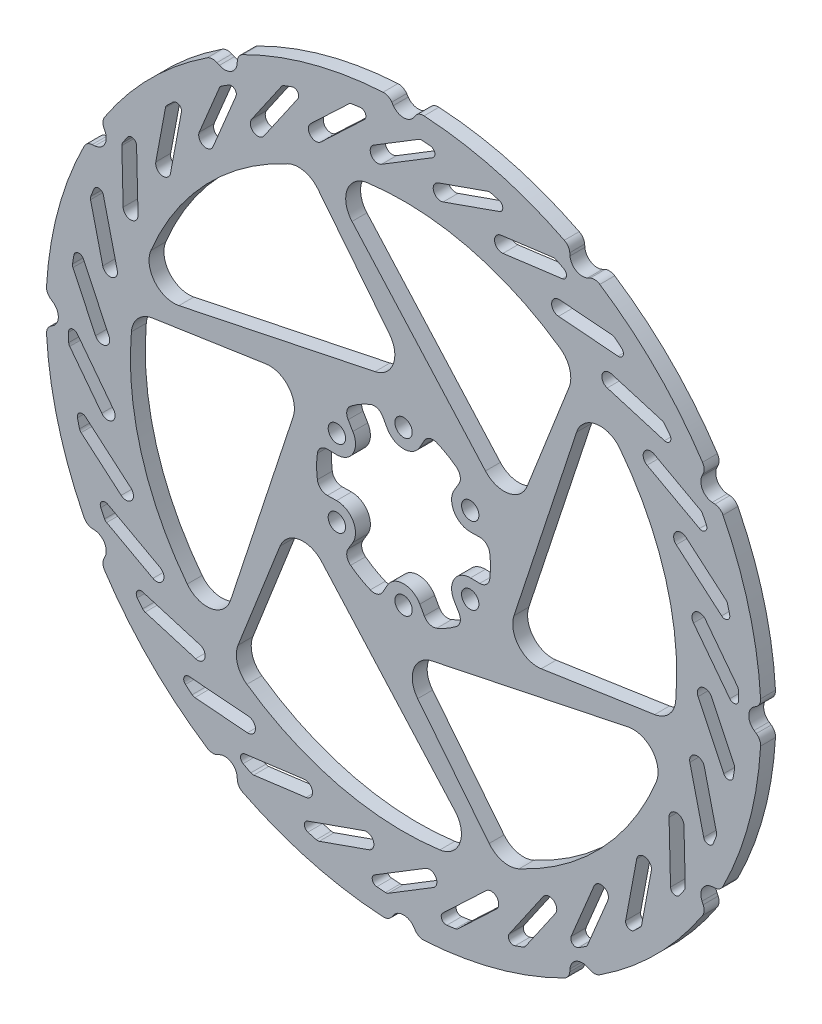
from build123d import *

# Parameters (mm, degrees)
BOSS_EXTRUDE1_DEPTH = 3
CUT_EXTRUDE1_DEPTH  = 3
SKETCH3_R           = 1.75
CUT_EXTRUDE2_DEPTH  = 3
CUT_EXTRUDE3_DEPTH  = 3


with BuildPart() as part:
    # Sketch1 → Boss-Extrude1 (new body)
    with BuildSketch(Plane.XY):
        with BuildLine():
            Line((2.053618112, 70.574288722), (2.366955706, 71.025625375))
            ThreePointArc((2.366955706, 71.025625375), (3.133954664, 71.683057192), (4.124417344, 71.881772248))
            ThreePointArc((4.124417344, 71.881772248), (18.634971247, 69.546659493), (32.369035928, 64.313649508))
            ThreePointArc((32.369035928, 64.313649508), (33.127444243, 63.646325881), (33.462968917, 62.693473748))
            Line((33.462968917, 62.693473748), (33.508658906, 62.145935943))
            ThreePointArc((33.508658906, 62.145935943), (34.75, 60.188765563), (37.065629816, 60.092317831))
            Line((37.065629816, 60.092317831), (37.562656459, 60.326518042))
            ThreePointArc((37.562656459, 60.326518042), (38.555612949, 60.512371217), (39.51273632, 60.189232164))
            ThreePointArc((39.51273632, 60.189232164), (50.911688245, 50.911688245), (60.189232164, 39.51273632))
            ThreePointArc((60.189232164, 39.51273632), (60.512371217, 38.555612949), (60.326518042, 37.562656459))
            Line((60.326518042, 37.562656459), (60.092317831, 37.065629816))
            ThreePointArc((60.092317831, 37.065629816), (60.188765563, 34.75), (62.145935943, 33.508658906))
            Line((62.145935943, 33.508658906), (62.693473748, 33.462968917))
            ThreePointArc((62.693473748, 33.462968917), (63.646325881, 33.127444243), (64.313649508, 32.369035928))
            ThreePointArc((64.313649508, 32.369035928), (69.546659493, 18.634971247), (71.881772248, 4.124417344))
            ThreePointArc((71.881772248, 4.124417344), (71.683057192, 3.133954664), (71.025625375, 2.366955706))
            Line((71.025625375, 2.366955706), (70.574288722, 2.053618112))
            ThreePointArc((70.574288722, 2.053618112), (69.5, 0), (70.574288722, -2.053618112))
            Line((70.574288722, -2.053618112), (71.025625375, -2.366955706))
            ThreePointArc((71.025625375, -2.366955706), (71.683057192, -3.133954664), (71.881772248, -4.124417344))
            ThreePointArc((71.881772248, -4.124417344), (69.546659493, -18.634971247), (64.313649508, -32.369035928))
            ThreePointArc((64.313649508, -32.369035928), (63.646325881, -33.127444243), (62.693473748, -33.462968917))
            Line((62.693473748, -33.462968917), (62.145935943, -33.508658906))
            ThreePointArc((62.145935943, -33.508658906), (60.188765563, -34.75), (60.092317831, -37.065629816))
            Line((60.092317831, -37.065629816), (60.326518042, -37.562656459))
            ThreePointArc((60.326518042, -37.562656459), (60.512371217, -38.555612949), (60.189232164, -39.51273632))
            ThreePointArc((60.189232164, -39.51273632), (50.911688245, -50.911688245), (39.51273632, -60.189232164))
            ThreePointArc((39.51273632, -60.189232164), (38.555612949, -60.512371217), (37.562656459, -60.326518042))
            Line((37.562656459, -60.326518042), (37.065629816, -60.092317831))
            ThreePointArc((37.065629816, -60.092317831), (34.75, -60.188765563), (33.508658906, -62.145935943))
            Line((33.508658906, -62.145935943), (33.462968917, -62.693473748))
            ThreePointArc((33.462968917, -62.693473748), (33.127444243, -63.646325881), (32.369035928, -64.313649508))
            ThreePointArc((32.369035928, -64.313649508), (18.634971247, -69.546659493), (4.124417344, -71.881772248))
            ThreePointArc((4.124417344, -71.881772248), (3.133954664, -71.683057192), (2.366955706, -71.025625375))
            Line((2.366955706, -71.025625375), (2.053618112, -70.574288722))
            ThreePointArc((2.053618112, -70.574288722), (0, -69.5), (-2.053618112, -70.574288722))
            Line((-2.053618112, -70.574288722), (-2.366955706, -71.025625375))
            ThreePointArc((-2.366955706, -71.025625375), (-3.133954664, -71.683057192), (-4.124417344, -71.881772248))
            ThreePointArc((-4.124417344, -71.881772248), (-18.634971247, -69.546659493), (-32.369035928, -64.313649508))
            ThreePointArc((-32.369035928, -64.313649508), (-33.127444243, -63.646325881), (-33.462968917, -62.693473748))
            Line((-33.462968917, -62.693473748), (-33.508658906, -62.145935943))
            ThreePointArc((-33.508658906, -62.145935943), (-34.75, -60.188765563), (-37.065629816, -60.092317831))
            Line((-37.065629816, -60.092317831), (-37.562656459, -60.326518042))
            ThreePointArc((-37.562656459, -60.326518042), (-38.555612949, -60.512371217), (-39.51273632, -60.189232164))
            ThreePointArc((-39.51273632, -60.189232164), (-50.911688245, -50.911688245), (-60.189232164, -39.51273632))
            ThreePointArc((-60.189232164, -39.51273632), (-60.512371217, -38.555612949), (-60.326518042, -37.562656458))
            Line((-60.326518042, -37.562656458), (-60.092317831, -37.065629816))
            ThreePointArc((-60.092317831, -37.065629816), (-60.188765563, -34.75), (-62.145935943, -33.508658906))
            Line((-62.145935943, -33.508658906), (-62.693473748, -33.462968917))
            ThreePointArc((-62.693473748, -33.462968917), (-63.646325881, -33.127444243), (-64.313649508, -32.369035928))
            ThreePointArc((-64.313649508, -32.369035928), (-69.546659493, -18.634971247), (-71.881772248, -4.124417344))
            ThreePointArc((-71.881772248, -4.124417344), (-71.683057192, -3.133954664), (-71.025625375, -2.366955706))
            Line((-71.025625375, -2.366955706), (-70.574288722, -2.053618112))
            ThreePointArc((-70.574288722, -2.053618112), (-69.5, 0), (-70.574288722, 2.053618112))
            Line((-70.574288722, 2.053618112), (-71.025625375, 2.366955706))
            ThreePointArc((-71.025625375, 2.366955706), (-71.683057192, 3.133954664), (-71.881772248, 4.124417344))
            ThreePointArc((-71.881772248, 4.124417344), (-69.546659493, 18.634971247), (-64.313649508, 32.369035928))
            ThreePointArc((-64.313649508, 32.369035928), (-63.646325881, 33.127444243), (-62.693473748, 33.462968917))
            Line((-62.693473748, 33.462968917), (-62.145935943, 33.508658906))
            ThreePointArc((-62.145935943, 33.508658906), (-60.188765563, 34.75), (-60.092317831, 37.065629816))
            Line((-60.092317831, 37.065629816), (-60.326518042, 37.562656459))
            ThreePointArc((-60.326518042, 37.562656459), (-60.512371217, 38.555612949), (-60.189232164, 39.51273632))
            ThreePointArc((-60.189232164, 39.51273632), (-50.911688245, 50.911688245), (-39.51273632, 60.189232164))
            ThreePointArc((-39.51273632, 60.189232164), (-38.555612949, 60.512371217), (-37.562656459, 60.326518042))
            Line((-37.562656459, 60.326518042), (-37.065629816, 60.092317831))
            ThreePointArc((-37.065629816, 60.092317831), (-34.75, 60.188765563), (-33.508658906, 62.145935943))
            Line((-33.508658906, 62.145935943), (-33.462968917, 62.693473748))
            ThreePointArc((-33.462968917, 62.693473748), (-33.127444243, 63.646325881), (-32.369035928, 64.313649508))
            ThreePointArc((-32.369035928, 64.313649508), (-18.634971247, 69.546659493), (-4.124417344, 71.881772248))
            ThreePointArc((-4.124417344, 71.881772248), (-3.133954664, 71.683057192), (-2.366955706, 71.025625375))
            Line((-2.366955706, 71.025625375), (-2.053618112, 70.574288722))
            ThreePointArc((-2.053618112, 70.574288722), (0, 69.5), (2.053618112, 70.574288722))
        make_face()
    extrude(amount=BOSS_EXTRUDE1_DEPTH)

    # Sketch2 → Cut-Extrude1 (cut)
    with BuildSketch(Plane.XY.offset(3)):
        with BuildLine():
            Line((3.063050298, 67.256681304), (-5.992723389, 61.724264749))
            ThreePointArc((-5.992723389, 61.724264749), (-6.490747582, 59.662233735), (-4.428716568, 59.164209541))
            Line((-4.428716568, 59.164209541), (5.834166321, 65.434081687))
            ThreePointArc((5.834166321, 65.434081687), (6.28552662, 66.51951676), (5.392722905, 67.284236933))
            ThreePointArc((5.392722905, 67.284236933), (4.515887753, 67.348769534), (3.638286445, 67.401875877))
            ThreePointArc((3.638286445, 67.401875877), (3.339652884, 67.372920073), (3.063050298, 67.256681304))
        make_face()
        with BuildLine():
            Line((16.979565628, 65.150117484), (6.971428244, 61.621398723))
            ThreePointArc((6.971428244, 61.621398723), (6.055566719, 59.707973086), (7.968992356, 58.792111562))
            Line((7.968992356, 58.792111562), (19.31118635, 62.791198624))
            ThreePointArc((19.31118635, 62.791198624), (19.978357984, 63.759071253), (19.264058437, 64.692704786))
            ThreePointArc((19.264058437, 64.692704786), (18.41980132, 64.938131474), (17.572419135, 65.172540888))
            ThreePointArc((17.572419135, 65.172540888), (17.274291183, 65.206307246), (16.979565628, 65.150117484))
        make_face()
        with BuildLine():
            Line((30.153992464, 60.196180905), (19.63089501, 58.825381881))
            ThreePointArc((19.63089501, 58.825381881), (18.337223697, 57.144187504), (20.018418075, 55.850516191))
            Line((20.018418075, 55.850516191), (31.94421487, 57.404038876))
            ThreePointArc((31.94421487, 57.404038876), (32.798039238, 58.212048383), (32.293462177, 59.27379101))
            ThreePointArc((32.293462177, 59.27379101), (31.51868118, 59.689385461), (30.738552786, 60.094853129))
            ThreePointArc((30.738552786, 60.094853129), (30.453960067, 60.189865898), (30.153992464, 60.196180905))
        make_face()
        with BuildLine():
            Line((42.010545134, 52.611382368), (31.432397464, 53.458413576))
            ThreePointArc((31.432397464, 53.458413576), (29.817456008, 52.082926719), (31.192942865, 50.467985263))
            Line((31.192942865, 50.467985263), (43.181127915, 49.508047173))
            ThreePointArc((43.181127915, 49.508047173), (44.184288795, 50.120879666), (43.911486657, 51.264328139))
            ThreePointArc((43.911486657, 51.264328139), (43.24004343, 51.831926881), (42.561264182, 52.390731921))
            ThreePointArc((42.561264182, 52.390731921), (42.302644761, 52.542838587), (42.010545134, 52.611382368))
        make_face()
        with BuildLine():
            Line((52.031035393, 42.727213963), (41.86015332, 45.755056075))
            ThreePointArc((41.86015332, 45.755056075), (39.994522411, 44.745392115), (41.004186372, 42.879761206))
            Line((41.004186372, 42.879761206), (52.530818464, 39.448316243))
            ThreePointArc((52.530818464, 39.448316243), (53.639472912, 39.839188001), (53.610368461, 41.014368135))
            ThreePointArc((53.610368461, 41.014368135), (53.071608292, 41.70916438), (52.5238441, 42.39688433))
            ThreePointArc((52.5238441, 42.39688433), (52.302500889, 42.599437101), (52.031035393, 42.727213963))
        make_face()
        with BuildLine():
            Line((59.777519732, 30.975661281), (50.458419608, 36.051983067))
            ThreePointArc((50.458419608, 36.051983067), (48.42363627, 35.452269163), (49.023350174, 33.417485825))
            Line((49.023350174, 33.417485825), (59.584660175, 27.6645046))
            ThreePointArc((59.584660175, 27.6645046), (60.750354671, 27.816332651), (60.966219911, 28.971883435))
            ThreePointArc((60.966219911, 28.971883435), (60.583689207, 29.763511252), (60.190879995, 30.550089451))
            ThreePointArc((60.190879995, 30.550089451), (60.016486753, 30.794235799), (59.777519732, 30.975661281))
        make_face()
        with BuildLine():
            Line((64.911439615, 17.870323562), (56.851410833, 24.773265402))
            ThreePointArc((56.851410833, 24.773265402), (54.736404861, 24.60971193), (54.899958333, 22.494705958))
            Line((54.899958333, 22.494705958), (64.034366318, 14.671621356))
            ThreePointArc((64.034366318, 14.671621356), (65.206154419, 14.577770086), (65.657555003, 15.663188406))
            ThreePointArc((65.657555003, 15.663188406), (65.447972191, 16.517049862), (65.227285605, 17.368109067))
            ThreePointArc((65.227285605, 17.368109067), (65.107464154, 17.643178626), (64.911439615, 17.870323562))
        make_face()
        with BuildLine():
            Line((67.208418107, 3.983966953), (60.759722602, 12.411837163))
            ThreePointArc((60.759722602, 12.411837163), (58.656929906, 12.691592195), (58.377174874, 10.588799499))
            Line((58.377174874, 10.588799499), (65.685463381, 1.037517857))
            ThreePointArc((65.685463381, 1.037517857), (66.812132325, 0.702089017), (67.479339881, 1.669936884))
            ThreePointArc((67.479339881, 1.669936884), (67.451864735, 2.548714135), (67.41294584, 3.427058976))
            ThreePointArc((67.41294584, 3.427058976), (67.352932952, 3.721029885), (67.208418107, 3.983966953))
        make_face()
        with BuildLine():
            Line((66.568066226, -10.076508129), (62.012542935, -0.492047918))
            ThreePointArc((62.012542935, -0.492047918), (60.013865646, 0.21878898), (59.303028748, -1.779888309))
            Line((59.303028748, -1.779888309), (64.465790501, -12.641930152))
            ThreePointArc((64.465790501, -12.641930152), (65.498099448, -13.204276712), (66.351953805, -12.396298894))
            ThreePointArc((66.351953805, -12.396298894), (66.507787121, -11.53101263), (66.652336858, -10.663770038))
            ThreePointArc((66.652336858, -10.663770038), (66.654755384, -10.363745717), (66.568066226, -10.076508129))
        make_face()
        with BuildLine():
            Line((63.018370421, -23.696591454), (60.555117572, -13.374428144))
            ThreePointArc((60.555117572, -13.374428144), (58.747907479, -12.263576363), (57.637055698, -14.070786456))
            Line((57.637055698, -14.070786456), (60.428653235, -25.768865149))
            ThreePointArc((60.428653235, -25.768865149), (61.321485331, -26.533552186), (62.324668955, -25.920756926))
            ThreePointArc((62.324668955, -25.920756926), (62.65700007, -25.106778811), (62.978700922, -24.28854113))
            ThreePointArc((62.978700922, -24.28854113), (63.043445161, -23.995575901), (63.018370421, -23.696591454))
        make_face()
        with BuildLine():
            Line((56.714469434, -36.281020023), (56.451142997, -25.672281682))
            ThreePointArc((56.451142997, -25.672281682), (54.914383852, -24.209964572), (53.452066742, -25.746723717))
            Line((53.452066742, -25.746723717), (53.750493854, -37.769577088))
            ThreePointArc((53.750493854, -37.769577088), (54.464828051, -38.703184109), (55.573497006, -38.312353498))
            ThreePointArc((55.573497006, -38.312353498), (56.067801454, -37.585258282), (56.55259355, -36.851786426))
            ThreePointArc((56.55259355, -36.851786426), (56.676833869, -36.578684274), (56.714469434, -36.281020023))
        make_face()
        with BuildLine():
            Line((47.931873986, -47.279793921), (49.879982589, -36.848133322))
            ThreePointArc((49.879982589, -36.848133322), (48.680838142, -35.098261157), (46.930965977, -36.297405604))
            Line((46.930965977, -36.297405604), (44.723179968, -48.119577268))
            ThreePointArc((44.723179968, -48.119577268), (45.227796435, -49.181301167), (46.393496565, -49.02951638))
            ThreePointArc((46.393496565, -49.02951638), (47.028170871, -48.421081612), (47.654866471, -47.80443182))
            ThreePointArc((47.654866471, -47.80443182), (47.833172971, -47.56312862), (47.931873986, -47.279793921))
        make_face()
        with BuildLine():
            Line((37.054425643, -56.212213952), (41.128827592, -46.413544718))
            ThreePointArc((41.128827592, -46.413544718), (40.319706208, -44.452595309), (38.358756799, -45.261716692))
            Line((38.358756799, -45.261716692), (33.741248511, -56.366521019))
            ThreePointArc((33.741248511, -56.366521019), (34.014093087, -57.509959366), (35.185877705, -57.603854126))
            ThreePointArc((35.185877705, -57.603854126), (35.933183555, -57.140671326), (36.674393053, -56.667794153))
            ThreePointArc((36.674393053, -56.667794153), (36.898972885, -56.468836013), (37.054425643, -56.212213952))
        make_face()
        with BuildLine():
            Line((24.557521092, -62.687890497), (30.580145471, -53.950461494))
            ThreePointArc((30.580145471, -53.950461494), (30.196409638, -51.864137739), (28.110085883, -52.247873571))
            Line((28.110085883, -52.247873571), (21.284662586, -62.149977325))
            ThreePointArc((21.284662586, -62.149977325), (21.313810653, -63.325156378), (22.440467148, -63.660627033))
            ThreePointArc((22.440467148, -63.660627033), (23.267743691, -63.362939511), (24.091072676, -63.054501959))
            ThreePointArc((24.091072676, -63.054501959), (24.352110623, -62.906584304), (24.557521092, -62.687890497))
        make_face()
        with BuildLine():
            Line((10.987335029, -66.423805417), (18.694964253, -59.129484219))
            ThreePointArc((18.694964253, -59.129484219), (18.753385068, -57.008968478), (16.632869327, -56.950547662))
            Line((16.632869327, -56.950547662), (7.897834771, -65.217181393))
            ThreePointArc((7.897834771, -65.217181393), (7.682012419, -66.372740188), (8.714300495, -66.935125061))
            ThreePointArc((8.714300495, -66.935125061), (9.585391777, -66.815943191), (10.454856821, -66.68542546))
            ThreePointArc((10.454856821, -66.68542546), (10.740944272, -66.595013002), (10.987335029, -66.423805417))
        make_face()
        with BuildLine():
            Line((-3.063050298, -67.256681304), (5.992723389, -61.724264749))
            ThreePointArc((5.992723389, -61.724264749), (6.490747582, -59.662233735), (4.428716568, -59.164209541))
            Line((4.428716568, -59.164209541), (-5.834166321, -65.434081687))
            ThreePointArc((-5.834166321, -65.434081687), (-6.28552662, -66.51951676), (-5.392722905, -67.284236933))
            ThreePointArc((-5.392722905, -67.284236933), (-4.515887753, -67.348769534), (-3.638286445, -67.401875877))
            ThreePointArc((-3.638286445, -67.401875877), (-3.339652884, -67.372920073), (-3.063050298, -67.256681304))
        make_face()
        with BuildLine():
            Line((-16.979565628, -65.150117484), (-6.971428244, -61.621398723))
            ThreePointArc((-6.971428244, -61.621398723), (-6.055566719, -59.707973086), (-7.968992356, -58.792111562))
            Line((-7.968992356, -58.792111562), (-19.31118635, -62.791198624))
            ThreePointArc((-19.31118635, -62.791198624), (-19.978357984, -63.759071253), (-19.264058437, -64.692704786))
            ThreePointArc((-19.264058437, -64.692704786), (-18.41980132, -64.938131474), (-17.572419135, -65.172540888))
            ThreePointArc((-17.572419135, -65.172540888), (-17.274291183, -65.206307246), (-16.979565628, -65.150117484))
        make_face()
        with BuildLine():
            Line((-30.153992464, -60.196180905), (-19.63089501, -58.825381881))
            ThreePointArc((-19.63089501, -58.825381881), (-18.337223697, -57.144187504), (-20.018418075, -55.850516191))
            Line((-20.018418075, -55.850516191), (-31.94421487, -57.404038876))
            ThreePointArc((-31.94421487, -57.404038876), (-32.798039238, -58.212048383), (-32.293462177, -59.27379101))
            ThreePointArc((-32.293462177, -59.27379101), (-31.51868118, -59.689385461), (-30.738552786, -60.094853129))
            ThreePointArc((-30.738552786, -60.094853129), (-30.453960067, -60.189865898), (-30.153992464, -60.196180905))
        make_face()
        with BuildLine():
            Line((-42.010545134, -52.611382368), (-31.432397464, -53.458413576))
            ThreePointArc((-31.432397464, -53.458413576), (-29.817456008, -52.082926719), (-31.192942865, -50.467985263))
            Line((-31.192942865, -50.467985263), (-43.181127915, -49.508047173))
            ThreePointArc((-43.181127915, -49.508047173), (-44.184288795, -50.120879666), (-43.911486657, -51.264328139))
            ThreePointArc((-43.911486657, -51.264328139), (-43.24004343, -51.831926881), (-42.561264182, -52.390731921))
            ThreePointArc((-42.561264182, -52.390731921), (-42.302644761, -52.542838587), (-42.010545134, -52.611382368))
        make_face()
        with BuildLine():
            Line((-52.031035393, -42.727213963), (-41.86015332, -45.755056075))
            ThreePointArc((-41.86015332, -45.755056075), (-39.994522411, -44.745392115), (-41.004186372, -42.879761206))
            Line((-41.004186372, -42.879761206), (-52.530818464, -39.448316243))
            ThreePointArc((-52.530818464, -39.448316243), (-53.639472912, -39.839188001), (-53.610368461, -41.014368135))
            ThreePointArc((-53.610368461, -41.014368135), (-53.071608292, -41.70916438), (-52.5238441, -42.39688433))
            ThreePointArc((-52.5238441, -42.39688433), (-52.302500889, -42.599437101), (-52.031035393, -42.727213963))
        make_face()
        with BuildLine():
            Line((-59.777519732, -30.975661281), (-50.458419608, -36.051983067))
            ThreePointArc((-50.458419608, -36.051983067), (-48.42363627, -35.452269163), (-49.023350174, -33.417485825))
            Line((-49.023350174, -33.417485825), (-59.584660175, -27.6645046))
            ThreePointArc((-59.584660175, -27.6645046), (-60.750354671, -27.816332651), (-60.966219911, -28.971883435))
            ThreePointArc((-60.966219911, -28.971883435), (-60.583689207, -29.763511252), (-60.190879995, -30.550089451))
            ThreePointArc((-60.190879995, -30.550089451), (-60.016486753, -30.794235799), (-59.777519732, -30.975661281))
        make_face()
        with BuildLine():
            Line((-64.911439615, -17.870323562), (-56.851410833, -24.773265402))
            ThreePointArc((-56.851410833, -24.773265402), (-54.736404861, -24.60971193), (-54.899958333, -22.494705958))
            Line((-54.899958333, -22.494705958), (-64.034366318, -14.671621356))
            ThreePointArc((-64.034366318, -14.671621356), (-65.206154419, -14.577770086), (-65.657555003, -15.663188406))
            ThreePointArc((-65.657555003, -15.663188406), (-65.447972191, -16.517049862), (-65.227285605, -17.368109067))
            ThreePointArc((-65.227285605, -17.368109067), (-65.107464154, -17.643178626), (-64.911439615, -17.870323562))
        make_face()
        with BuildLine():
            Line((-67.208418107, -3.983966953), (-60.759722602, -12.411837163))
            ThreePointArc((-60.759722602, -12.411837163), (-58.656929906, -12.691592195), (-58.377174874, -10.588799499))
            Line((-58.377174874, -10.588799499), (-65.685463381, -1.037517857))
            ThreePointArc((-65.685463381, -1.037517857), (-66.812132325, -0.702089017), (-67.479339881, -1.669936884))
            ThreePointArc((-67.479339881, -1.669936884), (-67.451864735, -2.548714135), (-67.41294584, -3.427058976))
            ThreePointArc((-67.41294584, -3.427058976), (-67.352932952, -3.721029885), (-67.208418107, -3.983966953))
        make_face()
        with BuildLine():
            Line((-66.568066226, 10.076508129), (-62.012542935, 0.492047918))
            ThreePointArc((-62.012542935, 0.492047918), (-60.013865646, -0.21878898), (-59.303028748, 1.779888309))
            Line((-59.303028748, 1.779888309), (-64.465790501, 12.641930152))
            ThreePointArc((-64.465790501, 12.641930152), (-65.498099448, 13.204276712), (-66.351953805, 12.396298894))
            ThreePointArc((-66.351953805, 12.396298894), (-66.507787121, 11.53101263), (-66.652336858, 10.663770038))
            ThreePointArc((-66.652336858, 10.663770038), (-66.654755384, 10.363745717), (-66.568066226, 10.076508129))
        make_face()
        with BuildLine():
            Line((-63.018370421, 23.696591454), (-60.555117572, 13.374428144))
            ThreePointArc((-60.555117572, 13.374428144), (-58.747907479, 12.263576363), (-57.637055698, 14.070786456))
            Line((-57.637055698, 14.070786456), (-60.428653235, 25.768865149))
            ThreePointArc((-60.428653235, 25.768865149), (-61.321485331, 26.533552186), (-62.324668955, 25.920756926))
            ThreePointArc((-62.324668955, 25.920756926), (-62.65700007, 25.106778811), (-62.978700922, 24.28854113))
            ThreePointArc((-62.978700922, 24.28854113), (-63.043445161, 23.995575901), (-63.018370421, 23.696591454))
        make_face()
        with BuildLine():
            Line((-56.714469434, 36.281020023), (-56.451142997, 25.672281682))
            ThreePointArc((-56.451142997, 25.672281682), (-54.914383852, 24.209964572), (-53.452066742, 25.746723717))
            Line((-53.452066742, 25.746723717), (-53.750493854, 37.769577088))
            ThreePointArc((-53.750493854, 37.769577088), (-54.464828051, 38.703184109), (-55.573497006, 38.312353498))
            ThreePointArc((-55.573497006, 38.312353498), (-56.067801454, 37.585258282), (-56.55259355, 36.851786426))
            ThreePointArc((-56.55259355, 36.851786426), (-56.676833869, 36.578684274), (-56.714469434, 36.281020023))
        make_face()
        with BuildLine():
            Line((-47.931873986, 47.279793921), (-49.879982589, 36.848133322))
            ThreePointArc((-49.879982589, 36.848133322), (-48.680838142, 35.098261157), (-46.930965977, 36.297405604))
            Line((-46.930965977, 36.297405604), (-44.723179968, 48.119577268))
            ThreePointArc((-44.723179968, 48.119577268), (-45.227796435, 49.181301167), (-46.393496565, 49.02951638))
            ThreePointArc((-46.393496565, 49.02951638), (-47.028170871, 48.421081612), (-47.654866471, 47.80443182))
            ThreePointArc((-47.654866471, 47.80443182), (-47.833172971, 47.56312862), (-47.931873986, 47.279793921))
        make_face()
        with BuildLine():
            Line((-37.054425643, 56.212213952), (-41.128827592, 46.413544718))
            ThreePointArc((-41.128827592, 46.413544718), (-40.319706208, 44.452595309), (-38.358756799, 45.261716692))
            Line((-38.358756799, 45.261716692), (-33.741248511, 56.366521019))
            ThreePointArc((-33.741248511, 56.366521019), (-34.014093087, 57.509959366), (-35.185877705, 57.603854126))
            ThreePointArc((-35.185877705, 57.603854126), (-35.933183555, 57.140671326), (-36.674393053, 56.667794153))
            ThreePointArc((-36.674393053, 56.667794153), (-36.898972885, 56.468836013), (-37.054425643, 56.212213952))
        make_face()
        with BuildLine():
            Line((-24.557521092, 62.687890497), (-30.580145471, 53.950461494))
            ThreePointArc((-30.580145471, 53.950461494), (-30.196409638, 51.864137739), (-28.110085883, 52.247873571))
            Line((-28.110085883, 52.247873571), (-21.284662586, 62.149977325))
            ThreePointArc((-21.284662586, 62.149977325), (-21.313810653, 63.325156378), (-22.440467148, 63.660627033))
            ThreePointArc((-22.440467148, 63.660627033), (-23.267743691, 63.362939511), (-24.091072676, 63.054501959))
            ThreePointArc((-24.091072676, 63.054501959), (-24.352110623, 62.906584304), (-24.557521092, 62.687890497))
        make_face()
        with BuildLine():
            Line((-10.987335029, 66.423805417), (-18.694964253, 59.129484219))
            ThreePointArc((-18.694964253, 59.129484219), (-18.753385068, 57.008968478), (-16.632869327, 56.950547662))
            Line((-16.632869327, 56.950547662), (-7.897834771, 65.217181393))
            ThreePointArc((-7.897834771, 65.217181393), (-7.682012419, 66.372740188), (-8.714300495, 66.935125061))
            ThreePointArc((-8.714300495, 66.935125061), (-9.585391777, 66.815943191), (-10.454856821, 66.68542546))
            ThreePointArc((-10.454856821, 66.68542546), (-10.740944272, 66.595013002), (-10.987335029, 66.423805417))
        make_face()
    extrude(amount=-CUT_EXTRUDE1_DEPTH, mode=Mode.SUBTRACT)

    # Sketch3 → Cut-Extrude2 (cut)
    with BuildSketch(Plane.XY.offset(3)):
        with Locations((0, 15.5)):
            Circle(SKETCH3_R)
        with Locations((13.423393759, 7.75)):
            Circle(SKETCH3_R)
        with Locations((13.423393759, -7.75)):
            Circle(SKETCH3_R)
        with Locations((0, -15.5)):
            Circle(SKETCH3_R)
        with Locations((-13.423393759, -7.75)):
            Circle(SKETCH3_R)
        with Locations((-13.423393759, 7.75)):
            Circle(SKETCH3_R)
        with BuildLine():
            Line((3.276147737, 13.675347702), (4.178578818, 15.29565506))
            ThreePointArc((4.178578818, 15.29565506), (5.268003964, 16.211217993), (6.690484399, 16.170572609))
            ThreePointArc((6.690484399, 16.170572609), (8.75, 15.155444566), (10.658884474, 13.879415758))
            ThreePointArc((10.658884474, 13.879415758), (11.405324626, 12.667834257), (11.157136441, 11.266582938))
            Line((11.157136441, 11.266582938), (10.205124647, 9.674901018))
            ThreePointArc((10.205124647, 9.674901018), (10.175798494, 5.875), (13.481272384, 4.000446685))
            Line((13.481272384, 4.000446685), (15.335715259, 4.029072122))
            ThreePointArc((15.335715259, 4.029072122), (16.67332859, 3.543383736), (17.349368873, 2.291156851))
            ThreePointArc((17.349368873, 2.291156851), (17.5, 0), (17.349368873, -2.291156851))
            ThreePointArc((17.349368873, -2.291156851), (16.67332859, -3.543383736), (15.335715259, -4.029072122))
            Line((15.335715259, -4.029072122), (13.481272384, -4.000446685))
            ThreePointArc((13.481272384, -4.000446685), (10.175798494, -5.875), (10.205124647, -9.674901018))
            Line((10.205124647, -9.674901018), (11.157136441, -11.266582938))
            ThreePointArc((11.157136441, -11.266582938), (11.405324626, -12.667834257), (10.658884474, -13.879415758))
            ThreePointArc((10.658884474, -13.879415758), (8.75, -15.155444566), (6.690484399, -16.170572609))
            ThreePointArc((6.690484399, -16.170572609), (5.268003964, -16.211217993), (4.178578818, -15.29565506))
            Line((4.178578818, -15.29565506), (3.276147737, -13.675347702))
            ThreePointArc((3.276147737, -13.675347702), (0, -11.75), (-3.276147737, -13.675347702))
            Line((-3.276147737, -13.675347702), (-4.178578818, -15.29565506))
            ThreePointArc((-4.178578818, -15.29565506), (-5.268003964, -16.211217993), (-6.690484399, -16.170572609))
            ThreePointArc((-6.690484399, -16.170572609), (-8.75, -15.155444566), (-10.658884474, -13.879415758))
            ThreePointArc((-10.658884474, -13.879415758), (-11.405324626, -12.667834257), (-11.157136441, -11.266582938))
            Line((-11.157136441, -11.266582938), (-10.205124647, -9.674901018))
            ThreePointArc((-10.205124647, -9.674901018), (-10.175798494, -5.875), (-13.481272384, -4.000446685))
            Line((-13.481272384, -4.000446685), (-15.335715259, -4.029072122))
            ThreePointArc((-15.335715259, -4.029072122), (-16.67332859, -3.543383736), (-17.349368873, -2.291156851))
            ThreePointArc((-17.349368873, -2.291156851), (-17.5, 0), (-17.349368873, 2.291156851))
            ThreePointArc((-17.349368873, 2.291156851), (-16.67332859, 3.543383736), (-15.335715259, 4.029072122))
            Line((-15.335715259, 4.029072122), (-13.481272384, 4.000446685))
            ThreePointArc((-13.481272384, 4.000446685), (-10.175798494, 5.875), (-10.205124647, 9.674901018))
            Line((-10.205124647, 9.674901018), (-11.157136441, 11.266582938))
            ThreePointArc((-11.157136441, 11.266582938), (-11.405324626, 12.667834257), (-10.658884474, 13.879415758))
            ThreePointArc((-10.658884474, 13.879415758), (-8.75, 15.155444566), (-6.690484399, 16.170572609))
            ThreePointArc((-6.690484399, 16.170572609), (-5.268003964, 16.211217993), (-4.178578818, 15.29565506))
            Line((-4.178578818, 15.29565506), (-3.276147737, 13.675347702))
            ThreePointArc((-3.276147737, 13.675347702), (0, 11.75), (3.276147737, 13.675347702))
        make_face()
    extrude(amount=-CUT_EXTRUDE2_DEPTH, mode=Mode.SUBTRACT)

    # Sketch4 → Cut-Extrude3 (cut)
    with BuildSketch(Plane.XY.offset(3)):
        with BuildLine():
            Line((-10.377107064, 46.224944133), (16.49239943, 16.147413528))
            ThreePointArc((16.49239943, 16.147413528), (21.102765549, 14.556828267), (24.874385583, 17.648804908))
            Line((24.874385583, 17.648804908), (33.3227725, 39.134381485))
            ThreePointArc((33.3227725, 39.134381485), (33.456835284, 42.407043097), (31.536534967, 45.060481159))
            ThreePointArc((31.536534967, 45.060481159), (13.000929891, 53.441330653), (-7.313147785, 54.511630589))
            ThreePointArc((-7.313147785, 54.511630589), (-11.338014751, 51.290019503), (-10.377107064, 46.224944133))
        make_face()
        with BuildLine():
            Line((27.721506188, -12.717447365), (50.552754777, -9.291176767))
            ThreePointArc((50.552754777, -9.291176767), (53.453994263, -7.770947738), (54.791788874, -4.781199849))
            ThreePointArc((54.791788874, -4.781199849), (52.782014903, 15.461529768), (43.551883, 33.589187058))
            ThreePointArc((43.551883, 33.589187058), (38.749452475, 35.464018554), (34.843422376, 32.099310402))
            Line((34.843422376, 32.099310402), (22.230270036, -6.209130111))
            ThreePointArc((22.230270036, -6.209130111), (23.157965852, -10.997116922), (27.721506188, -12.717447365))
        make_face()
        with BuildLine():
            Line((2.847120605, -30.366252273), (17.229982277, -48.425558252))
            ThreePointArc((17.229982277, -48.425558252), (19.997158979, -50.177990835), (23.255253907, -49.841681008))
            ThreePointArc((23.255253907, -49.841681008), (39.781085012, -37.979800885), (50.865030784, -20.922443531))
            ThreePointArc((50.865030784, -20.922443531), (50.087467226, -15.826000948), (45.220529439, -14.125633731))
            Line((45.220529439, -14.125633731), (5.737870606, -22.35654364))
            ThreePointArc((5.737870606, -22.35654364), (2.055200303, -25.553945189), (2.847120605, -30.366252273))
        make_face()
        with BuildLine():
            Line((-24.874385583, -17.648804908), (-33.3227725, -39.134381485))
            ThreePointArc((-33.3227725, -39.134381485), (-33.456835284, -42.407043097), (-31.536534967, -45.060481159))
            ThreePointArc((-31.536534967, -45.060481159), (-13.000929891, -53.441330653), (7.313147785, -54.511630589))
            ThreePointArc((7.313147785, -54.511630589), (11.338014751, -51.290019503), (10.377107064, -46.224944133))
            Line((10.377107064, -46.224944133), (-16.49239943, -16.147413528))
            ThreePointArc((-16.49239943, -16.147413528), (-21.102765549, -14.556828267), (-24.874385583, -17.648804908))
        make_face()
        with BuildLine():
            Line((-27.721506188, 12.717447365), (-50.552754777, 9.291176767))
            ThreePointArc((-50.552754777, 9.291176767), (-53.453994263, 7.770947738), (-54.791788874, 4.781199849))
            ThreePointArc((-54.791788874, 4.781199849), (-52.782014903, -15.461529768), (-43.551883, -33.589187058))
            ThreePointArc((-43.551883, -33.589187058), (-38.749452475, -35.464018554), (-34.843422376, -32.099310402))
            Line((-34.843422376, -32.099310402), (-22.230270036, 6.209130111))
            ThreePointArc((-22.230270036, 6.209130111), (-23.157965852, 10.997116922), (-27.721506188, 12.717447365))
        make_face()
        with BuildLine():
            Line((-2.847120605, 30.366252273), (-17.229982277, 48.425558252))
            ThreePointArc((-17.229982277, 48.425558252), (-19.997158979, 50.177990835), (-23.255253907, 49.841681008))
            ThreePointArc((-23.255253907, 49.841681008), (-39.781085012, 37.979800885), (-50.865030784, 20.922443531))
            ThreePointArc((-50.865030784, 20.922443531), (-50.087467226, 15.826000948), (-45.220529439, 14.125633731))
            Line((-45.220529439, 14.125633731), (-5.737870606, 22.35654364))
            ThreePointArc((-5.737870606, 22.35654364), (-2.055200303, 25.553945189), (-2.847120605, 30.366252273))
        make_face()
    extrude(amount=-CUT_EXTRUDE3_DEPTH, mode=Mode.SUBTRACT)


solid = part.part
